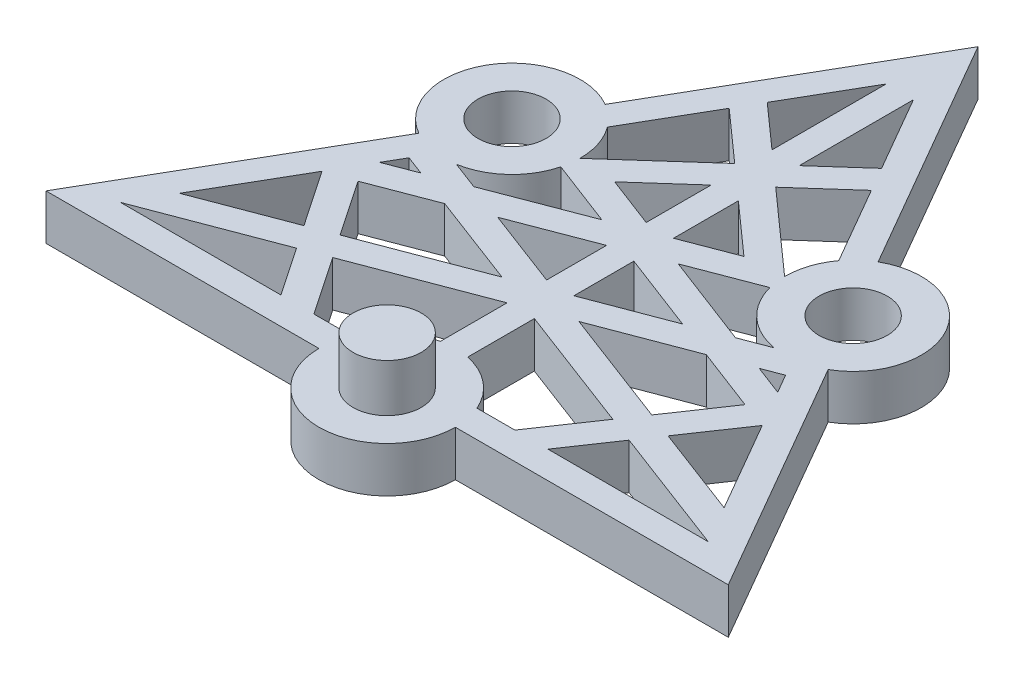
from build123d import *

# Parameters (mm, degrees)
EXTRUDE_THIN1_DEPTH = 2
SKETCH2_R           = 3
BOSS_EXTRUDE1_DEPTH = 2
SKETCH3_R           = 1.5
CUT_EXTRUDE1_DEPTH  = 23.73845331
SKETCH4_R           = 1.5
BOSS_EXTRUDE2_DEPTH = 2.1
EXTRUDE_THIN2_DEPTH = 2
EXTRUDE_THIN3_DEPTH = 2
SKETCH7_W           = 1.2
SKETCH7_H           = 23.975911633
EXTRUDE_THIN4_DEPTH = 2


with BuildPart() as part:
    # Sketch1 → Extrude-Thin1 (new body)
    with BuildSketch(Plane(origin=(0, 0, 0), x_dir=(1, 0, 0), z_dir=(0, 1, 0))):
        Polygon((-2.187026997, 14.752740827), (-17.187026997, -11.228021286), (12.812973003, -11.228021286), align=None)
        Polygon((-2.187026997, 12.352740827), (-15.108566028, -10.028021286), (10.734512034, -10.028021286), align=None, mode=Mode.SUBTRACT)
    extrude(amount=EXTRUDE_THIN1_DEPTH)

    # Sketch2 → Boss-Extrude1 (add)
    with BuildSketch(Plane(origin=(0, 0, 0), x_dir=(1, 0, 0), z_dir=(0, 1, 0))):
        with Locations((-9.687026997, 1.76235977)):
            Circle(SKETCH2_R)
        with Locations((5.312973003, 1.76235977)):
            Circle(SKETCH2_R)
        with Locations((-2.187026997, -11.228021286)):
            Circle(SKETCH2_R)
    extrude(amount=BOSS_EXTRUDE1_DEPTH)

    # Sketch3 → Cut-Extrude1 (cut, through all)
    with BuildSketch(Plane(origin=(0, 0, 0), x_dir=(1, 0, 0), z_dir=(0, 1, 0))):
        with Locations(Location((-9.687026997, 1.76235977, 0), (0, 0, 270))):
            Circle(SKETCH3_R)
        with Locations(Location((5.312973003, 1.76235977, 0), (0, 0, 270))):
            Circle(SKETCH3_R)
    extrude(amount=CUT_EXTRUDE1_DEPTH, mode=Mode.SUBTRACT)

    # Sketch4 → Boss-Extrude2 (add)
    with BuildSketch(Plane(origin=(0, 2, 0), x_dir=(1, 0, 0), z_dir=(0, 1, 0))):
        with Locations(Location((-2.187026997, -11.228021286, 0), (0, 0, 270))):
            Circle(SKETCH4_R)
    extrude(amount=BOSS_EXTRUDE2_DEPTH)

    # Sketch5 → Extrude-Thin2 (add)
    with BuildSketch(Plane(origin=(0, 0, 0), x_dir=(1, 0, 0), z_dir=(0, 1, 0))):
        Polygon((-5.388180626, 8.61177443), (2.926064281, 1.202897678), (-10.696610006, -3.999977956), (-6.443313294, -10.266536854), (-7.436211418, -10.940445836), (-12.540725216, -3.419753411), (0.654437519, 1.619843752), (-6.186526415, 7.715870417), align=None)
    extrude_thin2 = extrude(amount=EXTRUDE_THIN2_DEPTH)

    # Sketch6 → Extrude-Thin3 (add)
    with BuildSketch(Plane(origin=(0, 0, 0), x_dir=(1, 0, 0), z_dir=(0, 1, 0))):
        Polygon((-15.108566028, -10.028021286), (6.483160233, -1.838837543), (6.05761065, -0.716827048), (-15.534115611, -8.906010791), align=None)
    extrude_thin3 = extrude(amount=EXTRUDE_THIN3_DEPTH)

    # Mirror1: Extrude-Thin2, Extrude-Thin3 across plane
    add(extrude_thin2.mirror(Plane(origin=(-2.187026997, 0, 0), x_dir=(0, 0, 1), z_dir=(1, 0, 0))))
    add(extrude_thin3.mirror(Plane(origin=(-2.187026997, 0, 0), x_dir=(0, 0, 1), z_dir=(1, 0, 0))))

    # Sketch7 → Extrude-Thin4 (add)
    with BuildSketch(Plane(origin=(0, 0, 0), x_dir=(1, 0, 0), z_dir=(0, 1, 0))):
        with Locations((-2.187026997, 0.75993453)):
            Rectangle(SKETCH7_W, SKETCH7_H)
    extrude(amount=EXTRUDE_THIN4_DEPTH)


solid = part.part
